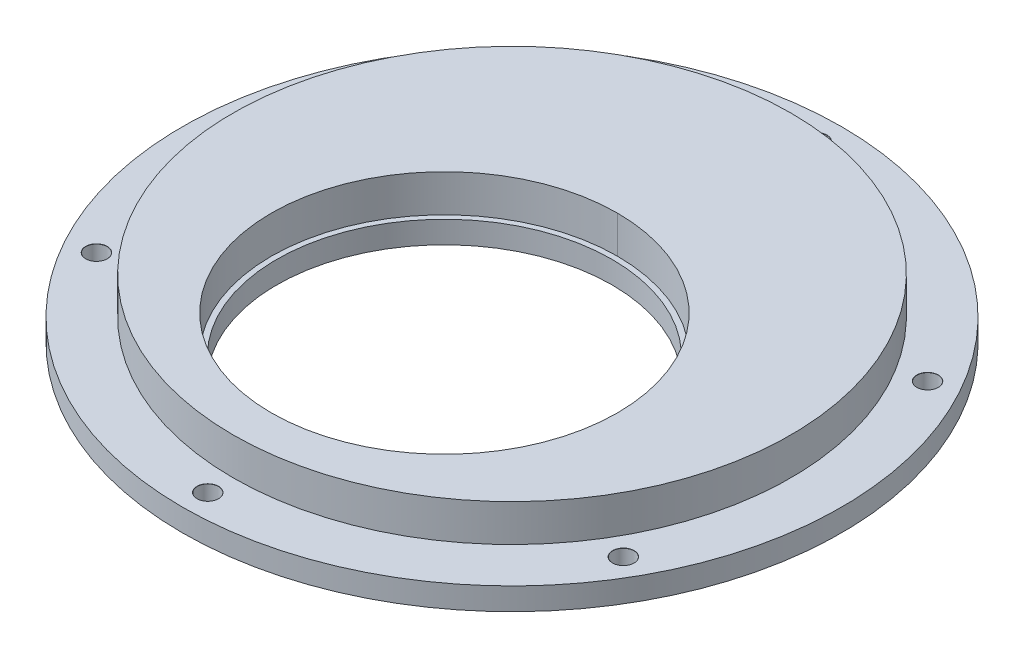
from build123d import *

# Parameters (mm, degrees)
SKETCH1_R                  = 61.9125
SKETCH1_R_2                = 30.988
SLOTTED_BODY_EXTRUDE_DEPTH = 4.191
SKETCH5_R                  = 52.3875
BOSS_EXTRUDE3_DEPTH        = 6.985
SKETCH6_R                  = 32.512
CUT_EXTRUDE5_DEPTH         = 89.267878011
SKETCH8_R                  = 32.512
SKETCH8_R_2                = 31.496
BOSS_EXTRUDE4_DEPTH        = 4.160000062
CIRPATTERN1_COUNT          = 6


with BuildPart() as part:
    # Sketch1 → Slotted-Body Extrude (new body)
    with BuildSketch(Plane(origin=(0, 0, 0), x_dir=(1, 0, 0), z_dir=(0, 1, 0))):
        with Locations(Location((0, 0, 0), (0, 0, 270))):
            Circle(SKETCH1_R)
        with Locations(Location((0, -12.7, 0), (0, 0, 270))):
            Circle(SKETCH1_R_2, mode=Mode.SUBTRACT)
    extrude(amount=SLOTTED_BODY_EXTRUDE_DEPTH)

    # Sketch5 → Boss-Extrude3 (add)
    with BuildSketch(Plane(origin=(0, 4.191, 0), x_dir=(1, 0, 0), z_dir=(0, 1, 0))):
        with Locations(Location((0, 0, 0), (0, 0, 270))):
            Circle(SKETCH5_R)
    extrude(amount=BOSS_EXTRUDE3_DEPTH)

    # Sketch6 → Cut-Extrude5 (cut, through all)
    with BuildSketch(Plane.XZ):
        with Locations(Location((0, 12.7, 0), (0, 0, 270))):
            Circle(SKETCH6_R)
    extrude(amount=-CUT_EXTRUDE5_DEPTH, mode=Mode.SUBTRACT)

    # Sketch10 → Ø4.0mm Dowel Hole2 (revolve, cut)
    with BuildSketch(Plane(origin=(0, 4.191, -57.15), x_dir=(0, 0, 1), z_dir=(1, 0, 0))):
        Polygon((0, 0), (0, 4.191), (2, 4.191), (2, 0.025), (2.025, 0), align=None)
    f_4_0mm_dowel_hole2 = revolve(axis=Axis((0, 10.541, -57.15), (0, -1, 0)), mode=Mode.SUBTRACT)

    # CirPattern1: Ø4.0mm Dowel Hole2 ×6 about axis
    cirpattern1_axis = Axis((0, 0, 0), (0, 1, 0))
    for i in range(1, CIRPATTERN1_COUNT):
        add(f_4_0mm_dowel_hole2.rotate(cirpattern1_axis, i * 360 / CIRPATTERN1_COUNT), mode=Mode.SUBTRACT)


with BuildPart() as body_2:
    # Sketch8 → Boss-Extrude4 (new body)
    with BuildSketch(Plane.XZ):
        with Locations(Location((0, 12.7, 0), (0, 0, 270))):
            Circle(SKETCH8_R)
        with Locations(Location((0, 12.7, 0), (0, 0, 270))):
            Circle(SKETCH8_R_2, mode=Mode.SUBTRACT)
    extrude(amount=-BOSS_EXTRUDE4_DEPTH)


solid = Compound([part.part, body_2.part])
